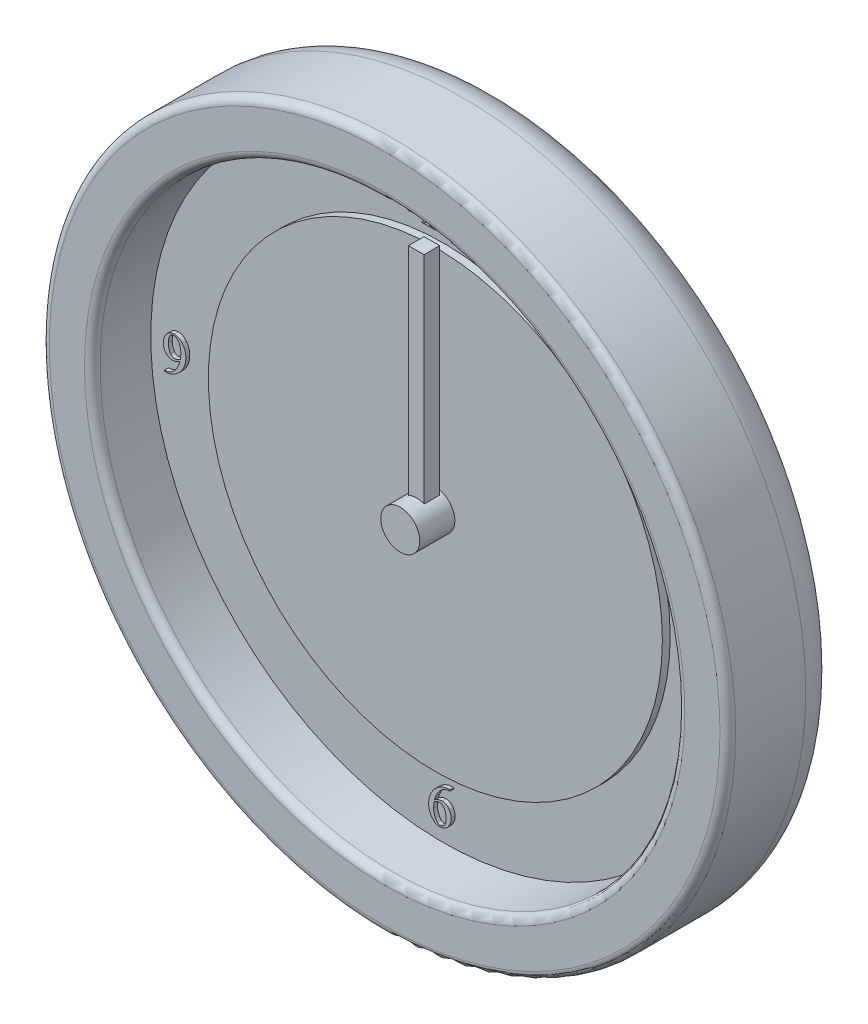
from build123d import *

# Parameters (mm, degrees)
SKETCH1_R            = 111.76
BOSS_EXTRUDE1_DEPTH  = 38.1
SKETCH2_R            = 95.25
CUT_EXTRUDE1_DEPTH   = 19.05
FILLET1_R            = 2.54
FILLET2_R            = 2.54
FILLET3_R            = 12.7
BOSS_EXTRUDE7_DEPTH  = 20.32
SKETCH4_R            = 6.35
BOSS_EXTRUDE8_DEPTH  = 13.97
SKETCH5_R            = 73.943171033
BOSS_EXTRUDE9_DEPTH  = 2.54
SKETCH6_W            = 5.08
SKETCH6_H            = 5.08
BOSS_EXTRUDE12_DEPTH = 76.2


with BuildPart() as part:
    # Sketch1 → Boss-Extrude1 (new body)
    with BuildSketch(Plane.XY):
        with Locations(Location((0, 0, 0), (0, 0, 180))):
            Circle(SKETCH1_R)
    extrude(amount=BOSS_EXTRUDE1_DEPTH)

    # Sketch2 → Cut-Extrude1 (cut)
    with BuildSketch(Plane.XY.offset(38.1)):
        Circle(SKETCH2_R)
    extrude(amount=-CUT_EXTRUDE1_DEPTH, mode=Mode.SUBTRACT)

    # Fillet1
    fillet1_edges = [part.edges().sort_by_distance(p)[0] for p in [
        (-95.25, 0, 38.1),
    ]]
    fillet(fillet1_edges, radius=FILLET1_R)

    # Fillet2
    fillet2_edges = [part.edges().sort_by_distance(p)[0] for p in [
        (111.76, 0, 38.1),
    ]]
    fillet(fillet2_edges, radius=FILLET2_R)

    # Fillet3
    fillet3_edges = [part.edges().sort_by_distance(p)[0] for p in [
        (111.76, 0, 0),
    ]]
    fillet(fillet3_edges, radius=FILLET3_R)

    # Sketch3 → Boss-Extrude7 (add)
    # profile 1 of 5: a face of its own
    with BuildSketch(Plane.XY):
        with BuildLine():
            Line((-5.75388779, 88.125760029), (-2.948611132, 89.430302853))
            Line((-2.948611132, 89.430302853), (-2.655598583, 89.430302853))
            Line((-2.655598583, 89.430302853), (-2.655598583, 79.646231672))
            add(Edge.make_bspline(
                [(-2.655598583, 79.646231672), (-2.654587099, 79.565552497), (-2.652670591, 79.412685694), (-2.652428934, 79.195145532), (-2.642505407, 79.002483635), (-2.637665058, 78.833153356), (-2.622670176, 78.688211965), (-2.612737323, 78.565249236), (-2.593972522, 78.466972643), (-2.572197261, 78.367611622), (-2.527322959, 78.266023365), (-2.451204632, 78.16146124), (-2.352854458, 78.072392027), (-2.227671184, 77.991718119), (-2.054179237, 77.935061791), (-1.82428506, 77.891100322), (-1.528314509, 77.862807229), (-1.308648477, 77.856144866), (-1.187987906, 77.852485289)],
                knots=[0, 0, 0, 0, 1.356933168, 2.571048021, 3.657379777, 4.601012336, 5.418253307, 6.107533085, 6.673460353, 7.099554724, 7.815972102, 8.521630774, 9.259509655, 10.036179522, 11.007509208, 12.304408113, 13.970044684, 16, 16, 16, 16], degree=3))
            Line((-1.187987906, 77.852485289), (-1.187987906, 77.526349583))
            Line((-1.187987906, 77.526349583), (-5.590819937, 77.526349583))
            Line((-5.590819937, 77.526349583), (-5.590819937, 77.852485289))
            add(Edge.make_bspline(
                [(-5.590819937, 77.852485289), (-5.467591539, 77.855984736), (-5.244494419, 77.862320259), (-4.946324027, 77.891869605), (-4.719395507, 77.931391262), (-4.552549752, 77.986786853), (-4.437330563, 78.065657451), (-4.34320301, 78.146019032), (-4.271554575, 78.241036136), (-4.220329465, 78.329520899), (-4.190427401, 78.420119835), (-4.175328155, 78.516452915), (-4.155809912, 78.638377842), (-4.145290521, 78.788345529), (-4.134884941, 78.964974728), (-4.12680821, 79.168002339), (-4.126004962, 79.398237803), (-4.124176263, 79.560453307), (-4.12320926, 79.646231672)],
                knots=[0, 0, 0, 0, 2.071302469, 3.74996044, 5.029173581, 5.941282905, 6.673651071, 7.361112001, 8.012044112, 8.663601818, 9.069808009, 9.607263055, 10.29959599, 11.144699654, 12.131164582, 13.273777592, 14.558393644, 16, 16, 16, 16], degree=3))
            Line((-4.12320926, 79.646231672), (-4.12320926, 86.00587794))
            add(Edge.make_bspline(
                [(-4.12320926, 86.00587794), (-4.122640277, 86.101008152), (-4.121553012, 86.282791459), (-4.128911149, 86.542621591), (-4.131184679, 86.77635111), (-4.143766859, 86.982559324), (-4.151098195, 87.162151909), (-4.16851871, 87.313840376), (-4.180721531, 87.440390417), (-4.19732904, 87.514357402), (-4.204743187, 87.547378738)],
                knots=[0, 0, 0, 0, 1.476765178, 2.821934835, 4.035278551, 5.104597693, 6.029081604, 6.824151588, 7.47506195, 8, 8, 8, 8], degree=3))
            add(Edge.make_bspline(
                [(-4.204743187, 87.547378738), (-4.215554023, 87.588492465), (-4.236046444, 87.666425365), (-4.282372737, 87.773406198), (-4.341452505, 87.864413436), (-4.43514491, 87.961472177), (-4.582891288, 88.049266691), (-4.715548821, 88.061119637), (-4.783124478, 88.067157519)],
                knots=[0, 0, 0, 0, 0.903062441, 1.711795068, 2.468214314, 3.196286531, 4.571790261, 6, 6, 6, 6], degree=3))
            add(Edge.make_bspline(
                [(-4.783124478, 88.067157519), (-4.83854234, 88.062631724), (-4.962012685, 88.052548306), (-5.160716596, 88.000981901), (-5.388178403, 87.914677091), (-5.546338439, 87.839919019), (-5.631586901, 87.799624323)],
                knots=[0, 0, 0, 0, 0.743837888, 1.657262055, 2.737261251, 4, 4, 4, 4], degree=3))
            Line((-5.631586901, 87.799624323), (-5.75388779, 88.125760029))
        make_face()
    # profile 2 of 5: a face of its own
    with BuildSketch(Plane.XY):
        with BuildLine():
            Line((8.92221898, 79.776176368), (8.109427651, 77.526349583))
            Line((8.109427651, 77.526349583), (1.258029889, 77.526349583))
            Line((1.258029889, 77.526349583), (1.258029889, 77.844841484))
            add(Edge.make_bspline(
                [(1.258029889, 77.844841484), (1.50318641, 78.070159756), (1.978355837, 78.506878118), (2.658475963, 79.150082345), (3.281569554, 79.762134709), (3.847785693, 80.342794631), (4.357645079, 80.891667256), (4.809944453, 81.410482973), (5.208403753, 81.894691378), (5.551174235, 82.353434183), (5.848962901, 82.789661663), (6.101221394, 83.215879983), (6.316337561, 83.631582783), (6.494649418, 84.037450977), (6.629920792, 84.435879645), (6.727504321, 84.824314686), (6.789426037, 85.203000738), (6.798087822, 85.452757707), (6.802336891, 85.57527689)],
                knots=[0, 0, 0, 0, 1.640196139, 3.179075376, 4.61094688, 5.942305235, 7.173872596, 8.30065911, 9.332401675, 10.262017718, 11.120692698, 11.932909408, 12.700076558, 13.425218913, 14.114511764, 14.770003029, 15.396620544, 16, 16, 16, 16], degree=3))
            add(Edge.make_bspline(
                [(6.802336891, 85.57527689), (6.800691717, 85.666262684), (6.797466664, 85.844623174), (6.762967423, 86.105459842), (6.709248296, 86.354236555), (6.637122297, 86.591732818), (6.537638762, 86.81491602), (6.422223779, 87.027690538), (6.279027448, 87.224488951), (6.120454417, 87.409423634), (5.945916439, 87.576215292), (5.761160531, 87.722171306), (5.569530126, 87.848701486), (5.36811603, 87.95130943), (5.156949723, 88.027313723), (4.938651077, 88.083470953), (4.71179838, 88.121398903), (4.556910787, 88.124295759), (4.478619986, 88.125760029)],
                knots=[0, 0, 0, 0, 1.134419306, 2.223815103, 3.275304008, 4.307399035, 5.313221346, 6.318597171, 7.32112197, 8.342723066, 9.354331769, 10.327252885, 11.276405737, 12.214555788, 13.139633085, 14.069852934, 15.024371439, 16, 16, 16, 16], degree=3))
            add(Edge.make_bspline(
                [(4.478619986, 88.125760029), (4.337067563, 88.120358914), (4.058327691, 88.109723236), (3.65325225, 88.010944258), (3.270342506, 87.853891012), (2.913506978, 87.634395669), (2.590042085, 87.354609576), (2.308631043, 87.015401501), (2.074802788, 86.61638457), (1.962915835, 86.321199774), (1.905205431, 86.168945793)],
                knots=[0, 0, 0, 0, 0.978774112, 1.927366301, 2.868767021, 3.835023234, 4.81480387, 5.817007219, 6.874029602, 8, 8, 8, 8], degree=3))
            Line((1.905205431, 86.168945793), (1.584165595, 86.168945793))
            add(Edge.make_bspline(
                [(1.584165595, 86.168945793), (1.603412897, 86.296721734), (1.641018009, 86.546368603), (1.729493999, 86.906040636), (1.834773377, 87.244313956), (1.966148761, 87.557656555), (2.113567652, 87.851301433), (2.284009917, 88.121101015), (2.476225354, 88.368472212), (2.691340165, 88.589553925), (2.921807834, 88.788435074), (3.168437106, 88.959485747), (3.427211576, 89.107715474), (3.702874404, 89.222704605), (3.99068936, 89.316239995), (4.292030092, 89.381212809), (4.6073294, 89.42414128), (4.822444591, 89.428221803), (4.932152452, 89.430302853)],
                knots=[0, 0, 0, 0, 1.200501633, 2.345523519, 3.439068721, 4.490246694, 5.499995932, 6.48995494, 7.451685612, 8.406391985, 9.352574024, 10.27676432, 11.192316343, 12.119031984, 13.047762957, 14.001652993, 14.980851257, 16, 16, 16, 16], degree=3))
            add(Edge.make_bspline(
                [(4.932152452, 89.430302853), (5.048610371, 89.427009147), (5.277145943, 89.420545619), (5.613549274, 89.380175484), (5.934894366, 89.308222099), (6.243032249, 89.209757025), (6.533557905, 89.077779145), (6.811783962, 88.922837426), (7.072254367, 88.73433557), (7.316430839, 88.52243735), (7.5407699, 88.292729719), (7.733273705, 88.046627643), (7.902921804, 87.79444451), (8.033787134, 87.527411284), (8.140162177, 87.25237201), (8.217075431, 86.967404509), (8.260756941, 86.670545804), (8.266850515, 86.469742725), (8.269947568, 86.367684739)],
                knots=[0, 0, 0, 0, 1.109419983, 2.177111989, 3.221343547, 4.242152537, 5.252521162, 6.255999647, 7.270763728, 8.308866099, 9.333003754, 10.32358272, 11.281716678, 12.222409134, 13.149434629, 14.0874794, 15.027963099, 16, 16, 16, 16], degree=3))
            add(Edge.make_bspline(
                [(8.269947568, 86.367684739), (8.265238161, 86.219532574), (8.255753069, 85.921143248), (8.171689982, 85.476290551), (8.043131359, 85.030184668), (7.916676591, 84.743369061), (7.852086195, 84.596869772)],
                knots=[0, 0, 0, 0, 0.968670703, 1.950973842, 2.953401185, 4, 4, 4, 4], degree=3))
            add(Edge.make_bspline(
                [(7.852086195, 84.596869772), (7.795885775, 84.478854677), (7.681279524, 84.238193355), (7.475959084, 83.884868851), (7.252692526, 83.523087692), (7.005073694, 83.154860297), (6.730079233, 82.783656607), (6.427129812, 82.409637183), (6.104903926, 82.026124845), (5.874968531, 81.774638536), (5.757683458, 81.646360807)],
                knots=[0, 0, 0, 0, 0.863272392, 1.760421205, 2.69783519, 3.672094839, 4.691137575, 5.748887515, 6.851756197, 8, 8, 8, 8], degree=3))
            add(Edge.make_bspline(
                [(5.757683458, 81.646360807), (5.584535221, 81.467897497), (5.254975524, 81.128221419), (4.784015183, 80.646249069), (4.359126511, 80.218401712), (3.986430637, 79.837776692), (3.657984148, 79.51220991), (3.377132229, 79.239313512), (3.145862974, 79.016986053), (3.006072637, 78.887627048), (2.944762994, 78.830892407)],
                knots=[0, 0, 0, 0, 1.49931882, 2.853711152, 4.0632012, 5.135089847, 6.065735724, 6.851603135, 7.496332836, 8, 8, 8, 8], degree=3))
            Line((2.944762994, 78.830892407), (6.045600136, 78.830892407))
            add(Edge.make_bspline(
                [(6.045600136, 78.830892407), (6.191696461, 78.831852326), (6.460171425, 78.833616328), (6.828046907, 78.846295059), (7.125032362, 78.863806637), (7.362069691, 78.894207969), (7.559222245, 78.939571757), (7.73660079, 79.000640886), (7.905735286, 79.077595334), (8.064299604, 79.175770248), (8.215283417, 79.292200873), (8.353759428, 79.433191156), (8.485260577, 79.592826721), (8.558499483, 79.713996192), (8.596083274, 79.776176368)],
                knots=[0, 0, 0, 0, 1.821637222, 3.347544769, 4.589491042, 5.530053278, 6.323823777, 7.107498442, 7.865641253, 8.635746017, 9.428031577, 10.236778878, 11.095173072, 12, 12, 12, 12], degree=3))
            Line((8.596083274, 79.776176368), (8.92221898, 79.776176368))
        make_face()
    # profile 3 of 5: a face of its own
    with BuildSketch(Plane.XY):
        with BuildLine():
            add(Edge.make_bspline(
                [(84.095597607, 2.795514807), (84.138208974, 2.89095857), (84.221545682, 3.077621645), (84.356012675, 3.346794434), (84.502878672, 3.59778303), (84.65629814, 3.832912008), (84.818486594, 4.051098251), (84.985708897, 4.253838274), (85.165436406, 4.436914277), (85.351234166, 4.606200469), (85.546983167, 4.75853285), (85.758052941, 4.88500563), (85.978366999, 4.995631464), (86.20968419, 5.087978769), (86.454099868, 5.156775375), (86.709234099, 5.203782021), (86.975639806, 5.236217483), (87.157266074, 5.23973684), (87.249941388, 5.241532602)],
                knots=[0, 0, 0, 0, 1.176091227, 2.300127321, 3.3835767, 4.446473798, 5.457585235, 6.441364894, 7.401036819, 8.341531155, 9.268576939, 10.186414906, 11.105297085, 12.040532869, 12.984371496, 13.957134865, 14.957622323, 16, 16, 16, 16], degree=3))
            add(Edge.make_bspline(
                [(87.249941388, 5.241532602), (87.362998498, 5.238217568), (87.583912739, 5.231739973), (87.905335206, 5.192435244), (88.206485298, 5.11986845), (88.487237654, 5.021428479), (88.748388121, 4.893594817), (88.985126683, 4.732494406), (89.208718871, 4.550912747), (89.334474742, 4.40530189), (89.397850765, 4.331919735)],
                knots=[0, 0, 0, 0, 1.123808988, 2.195929207, 3.211426243, 4.196579678, 5.14788152, 6.09136163, 7.038121192, 8, 8, 8, 8], degree=3))
            add(Edge.make_bspline(
                [(89.397850765, 4.331919735), (89.485416851, 4.22006281), (89.654440877, 4.00415151), (89.831559003, 3.641045504), (89.945553095, 3.267837557), (89.959231019, 3.012037684), (89.966040315, 2.884692539)],
                knots=[0, 0, 0, 0, 1.071729872, 2.068701529, 3.038539469, 4, 4, 4, 4], degree=3))
            add(Edge.make_bspline(
                [(89.966040315, 2.884692539), (89.960999465, 2.778086606), (89.950752033, 2.561369787), (89.869301704, 2.237033292), (89.740295178, 1.911100547), (89.559179465, 1.583403902), (89.326629094, 1.253821552), (89.045692891, 0.920276144), (88.712426553, 0.585545054), (88.464331944, 0.373235024), (88.335361785, 0.262867215)],
                knots=[0, 0, 0, 0, 0.802544778, 1.631475345, 2.504987027, 3.438672434, 4.445331875, 5.540090885, 6.721234327, 8, 8, 8, 8], degree=3))
            add(Edge.make_bspline(
                [(88.335361785, 0.262867215), (88.420853006, 0.227593405), (88.588539571, 0.158405669), (88.826686737, 0.034953234), (89.047358605, -0.100874647), (89.255780804, -0.242222924), (89.44515133, -0.399128325), (89.618409274, -0.56746662), (89.776810754, -0.746334283), (89.920283325, -0.934656907), (90.045360983, -1.134804294), (90.154284359, -1.343870592), (90.250202047, -1.559921316), (90.32329037, -1.786750621), (90.381745564, -2.020901383), (90.425405698, -2.263359854), (90.451593573, -2.514647948), (90.454012892, -2.68503059), (90.455243874, -2.771723612)],
                knots=[0, 0, 0, 0, 1.121628463, 2.200015641, 3.249715177, 4.264389965, 5.252559056, 6.229000805, 7.192526379, 8.148751574, 9.09789992, 10.051957494, 11.00718286, 11.961907919, 12.939056191, 13.933490933, 14.948531889, 16, 16, 16, 16], degree=3))
            add(Edge.make_bspline(
                [(90.455243874, -2.771723612), (90.452219237, -2.895853202), (90.446275423, -3.139784363), (90.401837176, -3.499606164), (90.329159072, -3.846237405), (90.222547928, -4.17973217), (90.090898283, -4.502144926), (89.926452947, -4.81147072), (89.732889677, -5.108427763), (89.582991435, -5.292895539), (89.507411978, -5.38590513)],
                knots=[0, 0, 0, 0, 1.048019005, 2.059496798, 3.056839529, 4.034491814, 5.012117791, 5.993865523, 6.98849678, 8, 8, 8, 8], degree=3))
            add(Edge.make_bspline(
                [(89.507411978, -5.38590513), (89.401439938, -5.500850506), (89.190154588, -5.730026747), (88.824513523, -6.02281695), (88.426443604, -6.27144467), (87.994554823, -6.477682845), (87.526216317, -6.634397629), (87.024117346, -6.745863668), (86.488208374, -6.812637694), (86.119702967, -6.821122949), (85.930110953, -6.82548852)],
                knots=[0, 0, 0, 0, 0.9408645, 1.875880513, 2.811526398, 3.763677692, 4.752375993, 5.780273647, 6.857974994, 8, 8, 8, 8], degree=3))
            add(Edge.make_bspline(
                [(85.930110953, -6.82548852), (85.83751913, -6.82441696), (85.659888878, -6.822361253), (85.404939319, -6.809460161), (85.172681855, -6.790185709), (84.963092485, -6.760633383), (84.777320865, -6.718745736), (84.612759408, -6.674807256), (84.47085401, -6.619646917), (84.321602298, -6.533337515), (84.17020444, -6.420595449), (84.037657154, -6.271373834), (83.947785996, -6.116703138), (83.93748597, -6.006920446), (83.932529754, -5.954094681)],
                knots=[0, 0, 0, 0, 1.402226433, 2.690062984, 3.865046374, 4.930988681, 5.892224942, 6.747350114, 7.509271635, 8.188907461, 9.354277059, 10.347676201, 11.204926872, 12, 12, 12, 12], degree=3))
            add(Edge.make_bspline(
                [(83.932529754, -5.954094681), (83.935070116, -5.915577369), (83.940094452, -5.839397738), (83.978188476, -5.728858546), (84.039725755, -5.625545649), (84.128012735, -5.535574143), (84.229760432, -5.456301983), (84.346630014, -5.401108632), (84.471027437, -5.361825158), (84.558154677, -5.359211979), (84.602636712, -5.357877843)],
                knots=[0, 0, 0, 0, 0.930288779, 1.839927393, 2.798379237, 3.815801145, 4.871906534, 5.901086166, 6.928418261, 8, 8, 8, 8], degree=3))
            add(Edge.make_bspline(
                [(84.602636712, -5.357877843), (84.673434022, -5.35977352), (84.818036651, -5.363645417), (84.958829184, -5.396939226), (85.030689826, -5.413932418)],
                knots=[0, 0, 0, 0, 0.9791981, 2, 2, 2, 2], degree=3))
            add(Edge.make_bspline(
                [(85.030689826, -5.413932418), (85.062188791, -5.423902809), (85.140319758, -5.448633663), (85.279130543, -5.500746484), (85.461809714, -5.578346507), (85.67604942, -5.671521039), (85.89308012, -5.766315939), (86.086093853, -5.842374788), (86.240319979, -5.898538302), (86.331687585, -5.923148279), (86.370903743, -5.933711199)],
                knots=[0, 0, 0, 0, 0.551098561, 1.366961252, 2.47206847, 3.861764831, 5.264472469, 6.422097681, 7.322743916, 8, 8, 8, 8], degree=3))
            add(Edge.make_bspline(
                [(86.370903743, -5.933711199), (86.476717764, -5.955375358), (86.694446276, -5.999952674), (86.916619729, -6.006687495), (87.030818961, -6.010149255)],
                knots=[0, 0, 0, 0, 0.971981303, 2, 2, 2, 2], degree=3))
            add(Edge.make_bspline(
                [(87.030818961, -6.010149255), (87.101475459, -6.008555733), (87.241047931, -6.005407943), (87.445421982, -5.969386232), (87.643576855, -5.920216727), (87.834081954, -5.844837731), (88.016414676, -5.747147155), (88.194661528, -5.632538533), (88.362357412, -5.493429055), (88.521922707, -5.336677583), (88.667628568, -5.164664502), (88.799286806, -4.984892975), (88.905783774, -4.793846891), (88.996499879, -4.597670738), (89.064338561, -4.392189565), (89.1170767, -4.180473701), (89.144123204, -3.959763041), (89.148488657, -3.810492682), (89.15070105, -3.734843119)],
                knots=[0, 0, 0, 0, 0.98287937, 1.941546881, 2.88253887, 3.822638359, 4.785601421, 5.759974566, 6.768635762, 7.814143594, 8.871295523, 9.905298752, 10.911738224, 11.912182368, 12.910876931, 13.920716429, 14.946228209, 16, 16, 16, 16], degree=3))
            add(Edge.make_bspline(
                [(89.15070105, -3.734843119), (89.14738922, -3.622490464), (89.140778093, -3.398210345), (89.083567622, -3.065734449), (88.999467709, -2.735547349), (88.912142271, -2.524521701), (88.867880242, -2.417560619)],
                knots=[0, 0, 0, 0, 0.993065039, 1.982371906, 2.977339071, 4, 4, 4, 4], degree=3))
            add(Edge.make_bspline(
                [(88.867880242, -2.417560619), (88.833654608, -2.342057844), (88.768124984, -2.197497526), (88.651611484, -2.002656741), (88.537592153, -1.830233904), (88.447154443, -1.736137169), (88.404156035, -1.691399086)],
                knots=[0, 0, 0, 0, 1.146959708, 2.196010144, 3.142297047, 4, 4, 4, 4], degree=3))
            add(Edge.make_bspline(
                [(88.404156035, -1.691399086), (88.342521084, -1.633882176), (88.213613227, -1.513587093), (87.987680834, -1.355876081), (87.730874547, -1.205138594), (87.447915715, -1.065012202), (87.148515391, -0.943057169), (86.838631505, -0.854940514), (86.52553305, -0.803203683), (86.315032529, -0.795705582), (86.210383825, -0.791977959)],
                knots=[0, 0, 0, 0, 0.833783525, 1.743836022, 2.720158816, 3.780630828, 4.867413274, 5.916185896, 6.964047963, 8, 8, 8, 8], degree=3))
            Line((86.210383825, -0.791977959), (85.950494435, -0.791977959))
            Line((85.950494435, -0.791977959), (85.950494435, -0.465842253))
            add(Edge.make_bspline(
                [(85.950494435, -0.465842253), (86.066507923, -0.447939435), (86.301374334, -0.411695628), (86.649971363, -0.309929048), (86.996572873, -0.167592704), (87.33812925, 0.004471306), (87.658371519, 0.205977347), (87.936406268, 0.43481377), (88.169435177, 0.682547347), (88.350673419, 0.95234691), (88.4893605, 1.238656021), (88.589482315, 1.538194784), (88.649481563, 1.852095258), (88.657459363, 2.065698782), (88.661497491, 2.173818618)],
                knots=[0, 0, 0, 0, 1.018822759, 2.062581231, 3.144841569, 4.269905924, 5.381171259, 6.423990724, 7.389747841, 8.324839968, 9.23548737, 10.145327579, 11.061219247, 12, 12, 12, 12], degree=3))
            add(Edge.make_bspline(
                [(88.661497491, 2.173818618), (88.660548918, 2.243582811), (88.658678275, 2.3811619), (88.628514515, 2.58122791), (88.586767554, 2.773220995), (88.521936226, 2.952577359), (88.443738518, 3.124139473), (88.341521656, 3.281335829), (88.228786859, 3.434167853), (88.092267859, 3.56861585), (87.948688155, 3.694839749), (87.791485663, 3.802161452), (87.626204528, 3.892780903), (87.453510865, 3.971960223), (87.270929685, 4.029123044), (87.07979587, 4.06981371), (86.880402921, 4.096619929), (86.743840796, 4.098895603), (86.674108032, 4.100057631)],
                knots=[0, 0, 0, 0, 1.07791789, 2.125717433, 3.123144222, 4.111969722, 5.069857656, 6.032059613, 7.006823601, 8.000784083, 8.988212443, 9.96111577, 10.93720663, 11.90155836, 12.894476591, 13.889044549, 14.92208211, 16, 16, 16, 16], degree=3))
            add(Edge.make_bspline(
                [(86.674108032, 4.100057631), (86.562555311, 4.095459859), (86.341704749, 4.086357252), (86.016334761, 4.019130315), (85.707521402, 3.901797328), (85.40949341, 3.746267305), (85.131441907, 3.537998445), (84.864917793, 3.288653363), (84.610954186, 2.994559883), (84.462686048, 2.772622059), (84.38606222, 2.657926306)],
                knots=[0, 0, 0, 0, 0.945780098, 1.8724426, 2.802290766, 3.739917435, 4.713776979, 5.738108685, 6.831072039, 8, 8, 8, 8], degree=3))
            Line((84.38606222, 2.657926306), (84.095597607, 2.795514807))
        make_face()
    # profile 4 of 5: a face of its own
    with BuildSketch(Plane.XY):
        with BuildLine():
            Line((-89.559201335, -6.394756041), (-89.559201335, -6.068620335))
            add(Edge.make_bspline(
                [(-89.559201335, -6.068620335), (-89.379591419, -6.060058037), (-89.023787869, -6.0430963), (-88.500544616, -5.944507518), (-87.998406489, -5.783493555), (-87.593487458, -5.607246038), (-87.281551091, -5.42797416), (-87.050081953, -5.267980889), (-86.81645176, -5.090337626), (-86.588105004, -4.885202817), (-86.360971013, -4.658138378), (-86.137617626, -4.407950878), (-85.914569017, -4.136197035), (-85.695486083, -3.844170719), (-85.485058696, -3.53496726), (-85.288319914, -3.214184269), (-85.110316639, -2.8829748), (-84.949594521, -2.542470835), (-84.803339692, -2.193609037), (-84.677591424, -1.833865709), (-84.56307455, -1.466581059), (-84.503503176, -1.216043217), (-84.473522669, -1.089954948)],
                knots=[0, 0, 0, 0, 1.403753885, 2.780807579, 4.145009348, 5.517530429, 6.22211579, 6.952842085, 7.714724661, 8.513818649, 9.34907323, 10.223127842, 11.133146991, 12.095383574, 13.074587166, 14.054510068, 15.034320612, 16.010934816, 16.995632226, 17.988413566, 18.987628183, 20, 20, 20, 20], degree=3))
            add(Edge.make_bspline(
                [(-84.473522669, -1.089954948), (-84.583088068, -1.161831273), (-84.796978918, -1.30214645), (-85.123134225, -1.483784497), (-85.438947674, -1.641983079), (-85.749078517, -1.766228128), (-86.049754263, -1.867175473), (-86.342672748, -1.939463153), (-86.628709031, -1.981511696), (-86.816646319, -1.988484559), (-86.909348723, -1.99192401)],
                knots=[0, 0, 0, 0, 1.193571056, 2.330059758, 3.39946611, 4.409696585, 5.371428751, 6.28736185, 7.155219939, 8, 8, 8, 8], degree=3))
            add(Edge.make_bspline(
                [(-86.909348723, -1.99192401), (-87.009710333, -1.98881237), (-87.207977127, -1.982665249), (-87.499571838, -1.939089975), (-87.780446647, -1.864067146), (-88.050976724, -1.760065116), (-88.309187285, -1.623677621), (-88.556352145, -1.458370404), (-88.792629264, -1.264666138), (-89.016618287, -1.044040267), (-89.219705634, -0.797237554), (-89.399254713, -0.528966065), (-89.549584321, -0.239848952), (-89.672111255, 0.068608069), (-89.769156326, 0.395082883), (-89.837460832, 0.741365023), (-89.879044871, 1.107037603), (-89.883205841, 1.357647901), (-89.885337041, 1.486007543)],
                knots=[0, 0, 0, 0, 0.941470417, 1.85989764, 2.758653354, 3.664270839, 4.573142615, 5.492502656, 6.449524564, 7.435563604, 8.437444669, 9.442994713, 10.458753649, 11.488604209, 12.552539664, 13.649559315, 14.796131987, 16, 16, 16, 16], degree=3))
            add(Edge.make_bspline(
                [(-89.885337041, 1.486007543), (-89.883466996, 1.611864391), (-89.879753315, 1.861800705), (-89.832510293, 2.229970475), (-89.769513877, 2.589701827), (-89.669938073, 2.936312506), (-89.549410194, 3.27523984), (-89.394167439, 3.599516098), (-89.219182214, 3.917898484), (-89.079569108, 4.116693424), (-89.008847331, 4.21739408)],
                knots=[0, 0, 0, 0, 1.034368591, 2.054129574, 3.048749262, 4.035093445, 5.016180263, 6.003612089, 6.988718856, 8, 8, 8, 8], degree=3))
            add(Edge.make_bspline(
                [(-89.008847331, 4.21739408), (-88.920642181, 4.333487897), (-88.748053765, 4.560645245), (-88.449509216, 4.855711218), (-88.134970432, 5.109432043), (-87.797673358, 5.314121076), (-87.441983908, 5.477704953), (-87.063170655, 5.587983821), (-86.665787399, 5.660008615), (-86.393291093, 5.668129652), (-86.254529376, 5.672265082)],
                knots=[0, 0, 0, 0, 1.077697514, 2.108698964, 3.097080646, 4.061760366, 5.02087614, 5.985228253, 6.974029447, 8, 8, 8, 8], degree=3))
            add(Edge.make_bspline(
                [(-86.254529376, 5.672265082), (-86.137076392, 5.66918757), (-85.905035107, 5.663107608), (-85.564288153, 5.604133148), (-85.235414911, 5.513451808), (-84.920697968, 5.381491654), (-84.618558983, 5.215747396), (-84.330973227, 5.011000377), (-84.053789769, 4.771658516), (-83.886466692, 4.58702543), (-83.800867776, 4.492571082)],
                knots=[0, 0, 0, 0, 1.001261744, 1.978102677, 2.941602562, 3.9064639, 4.882659592, 5.875812541, 6.913311016, 8, 8, 8, 8], degree=3))
            add(Edge.make_bspline(
                [(-83.800867776, 4.492571082), (-83.700661904, 4.369596486), (-83.50096903, 4.124529502), (-83.246898366, 3.723694836), (-83.029618017, 3.303561955), (-82.853009395, 2.861368931), (-82.714345102, 2.398574807), (-82.619417718, 1.912918447), (-82.558965014, 1.406845431), (-82.551220883, 1.062376005), (-82.547283655, 0.88724277)],
                knots=[0, 0, 0, 0, 0.975249514, 1.943502664, 2.913361846, 3.881741885, 4.868721614, 5.881196686, 6.922769767, 8, 8, 8, 8], degree=3))
            add(Edge.make_bspline(
                [(-82.547283655, 0.88724277), (-82.550438131, 0.727484468), (-82.556708237, 0.409935188), (-82.600345278, -0.06175732), (-82.675077833, -0.524461226), (-82.776890301, -0.980025343), (-82.908974101, -1.428020133), (-83.072728016, -1.866836942), (-83.265712363, -2.296630002), (-83.48239987, -2.718533538), (-83.731049195, -3.125389131), (-83.999880393, -3.51729847), (-84.29246258, -3.89179299), (-84.607357448, -4.248296198), (-84.948760698, -4.584997374), (-85.309537424, -4.906702367), (-85.696062751, -5.208338122), (-85.967298181, -5.393986957), (-86.104201199, -5.487691109)],
                knots=[0, 0, 0, 0, 1.007177407, 2.001952053, 2.983495718, 3.960383814, 4.943066043, 5.925748271, 6.910892874, 7.911959716, 8.913842499, 9.914909341, 10.906768658, 11.908179135, 12.911548943, 13.928077192, 14.954220372, 16, 16, 16, 16], degree=3))
            add(Edge.make_bspline(
                [(-86.104201199, -5.487691109), (-86.217906389, -5.559789365), (-86.444261477, -5.703316738), (-86.797673828, -5.888357611), (-87.158906148, -6.044643153), (-87.527506907, -6.173079453), (-87.904227904, -6.2716158), (-88.288831379, -6.344497517), (-88.681008855, -6.384559596), (-88.945066529, -6.391347865), (-89.077641581, -6.394756041)],
                knots=[0, 0, 0, 0, 1.023958831, 2.038414359, 3.031070775, 4.016000478, 5.004927743, 5.990874236, 6.991281152, 8, 8, 8, 8], degree=3))
            Line((-89.077641581, -6.394756041), (-89.559201335, -6.394756041))
        make_face()
        with BuildLine():
            add(Edge.make_bspline(
                [(-84.341030039, -0.447875277), (-84.316213617, -0.26964646), (-84.269251212, 0.067632375), (-84.218628523, 0.546008414), (-84.185004982, 0.968298163), (-84.180199118, 1.23116238), (-84.177962186, 1.353514912)],
                knots=[0, 0, 0, 0, 1.192878819, 2.257394654, 3.188888554, 4, 4, 4, 4], degree=3))
            add(Edge.make_bspline(
                [(-84.177962186, 1.353514912), (-84.181788291, 1.49633023), (-84.18962239, 1.788750077), (-84.242556076, 2.235063888), (-84.330299221, 2.697907669), (-84.449633, 3.165533089), (-84.595917171, 3.616059879), (-84.776655182, 4.02154199), (-84.984032219, 4.37315644), (-85.224487926, 4.662389877), (-85.485671928, 4.894951325), (-85.769294875, 5.060959696), (-86.072661066, 5.164008713), (-86.281775663, 5.176682745), (-86.387022007, 5.183061522)],
                knots=[0, 0, 0, 0, 1.062187864, 2.174870431, 3.338257157, 4.563963245, 5.762542175, 6.856781212, 7.85998215, 8.788504847, 9.643645159, 10.447577079, 11.218673208, 12, 12, 12, 12], degree=3))
            add(Edge.make_bspline(
                [(-86.387022007, 5.183061522), (-86.448335221, 5.181355087), (-86.570184412, 5.177963848), (-86.748860371, 5.143062343), (-86.922763556, 5.089269896), (-87.090046076, 5.012313153), (-87.252639454, 4.915344423), (-87.405377252, 4.792385401), (-87.557011681, 4.653321051), (-87.698152044, 4.489197644), (-87.833229586, 4.307364325), (-87.942570532, 4.09849691), (-88.041628844, 3.872877452), (-88.119633884, 3.624124985), (-88.180123302, 3.35471183), (-88.222226407, 3.064197409), (-88.252055696, 2.75379975), (-88.253773807, 2.53923107), (-88.254658511, 2.428743568)],
                knots=[0, 0, 0, 0, 0.792605237, 1.575163013, 2.346916721, 3.143778403, 3.952453891, 4.790187528, 5.676756025, 6.61148235, 7.587682155, 8.600865576, 9.654441308, 10.773736515, 11.968321315, 13.224332763, 14.570730166, 16, 16, 16, 16], degree=3))
            add(Edge.make_bspline(
                [(-88.254658511, 2.428743568), (-88.251876945, 2.280063484), (-88.246481546, 1.991668871), (-88.214430478, 1.571032107), (-88.155376854, 1.175377942), (-88.075413938, 0.803678706), (-87.970096112, 0.457019998), (-87.84377282, 0.134613609), (-87.691270844, -0.162356901), (-87.570130724, -0.343608735), (-87.510661431, -0.432587666)],
                knots=[0, 0, 0, 0, 1.188001522, 2.304365394, 3.367682703, 4.381928793, 5.33932953, 6.259201211, 7.145418771, 8, 8, 8, 8], degree=3))
            add(Edge.make_bspline(
                [(-87.510661431, -0.432587666), (-87.464783313, -0.491013346), (-87.37549249, -0.604725008), (-87.230957711, -0.75994408), (-87.073941252, -0.887603005), (-86.910120137, -0.993446916), (-86.737994099, -1.075498906), (-86.557749512, -1.135757434), (-86.368627209, -1.167897515), (-86.240196408, -1.173675875), (-86.175543385, -1.176584745)],
                knots=[0, 0, 0, 0, 1.120678164, 2.181132964, 3.191801348, 4.165735877, 5.117156532, 6.061301103, 7.024044508, 8, 8, 8, 8], degree=3))
            add(Edge.make_bspline(
                [(-86.175543385, -1.176584745), (-86.108302919, -1.173782955), (-85.967886779, -1.167932067), (-85.749085207, -1.128834648), (-85.512711655, -1.071176646), (-85.264620512, -0.986732237), (-85.012966028, -0.885154519), (-84.771291845, -0.761655702), (-84.547361549, -0.61436062), (-84.409809328, -0.503372101), (-84.341030039, -0.447875277)],
                knots=[0, 0, 0, 0, 0.80316604, 1.677226265, 2.649266336, 3.708091079, 4.804695908, 5.889265069, 6.944583761, 8, 8, 8, 8], degree=3))
        make_face(mode=Mode.SUBTRACT)
    # profile 5 of 5: a face of its own
    with BuildSketch(Plane.XY):
        with BuildLine():
            Line((3.545716517, -77.990113118), (3.545716517, -78.316248824))
            add(Edge.make_bspline(
                [(3.545716517, -78.316248824), (3.369569245, -78.336748013), (3.031578435, -78.376081788), (2.551877483, -78.471090423), (2.12351529, -78.599259641), (1.736267962, -78.75328099), (1.37862689, -78.948972656), (1.030048549, -79.182815352), (0.684270169, -79.461886897), (0.344481812, -79.77946636), (0.02070802, -80.12842475), (-0.27809901, -80.501442773), (-0.549205283, -80.894170775), (-0.790554131, -81.311028588), (-1.006411351, -81.757772934), (-1.20122731, -82.240012895), (-1.380903993, -82.761136391), (-1.480859963, -83.125283177), (-1.532318343, -83.312749758)],
                knots=[0, 0, 0, 0, 1.112103864, 2.133901259, 3.062589416, 3.913366634, 4.74287887, 5.614630287, 6.543135065, 7.526908882, 8.529641219, 9.526369413, 10.522342764, 11.520138158, 12.544667767, 13.631892204, 14.7808733, 16, 16, 16, 16], degree=3))
            add(Edge.make_bspline(
                [(-1.532318343, -83.312749758), (-1.430604104, -83.23899445), (-1.231685423, -83.094753991), (-0.921492776, -82.909078361), (-0.612792135, -82.750132365), (-0.304199972, -82.618835283), (0.006373228, -82.518816534), (0.316718344, -82.447973134), (0.627833196, -82.402217272), (0.835408525, -82.396035512), (0.939178804, -82.392945149)],
                knots=[0, 0, 0, 0, 1.123331773, 2.196857368, 3.229697486, 4.227207333, 5.192971132, 6.143860852, 7.072085882, 8, 8, 8, 8], degree=3))
            add(Edge.make_bspline(
                [(0.939178804, -82.392945149), (1.037042809, -82.395741765), (1.229632021, -82.401245302), (1.513315544, -82.449259999), (1.786920306, -82.525351275), (2.051104829, -82.633161652), (2.303917719, -82.772209063), (2.548750865, -82.93936641), (2.782702574, -83.138323799), (3.002447653, -83.367192424), (3.205817076, -83.617754761), (3.385195698, -83.888571897), (3.535567083, -84.177492244), (3.65872099, -84.483977165), (3.755303052, -84.807184651), (3.823814201, -85.148290769), (3.865494544, -85.506325465), (3.869702925, -85.751008471), (3.871852223, -85.875972572)],
                knots=[0, 0, 0, 0, 0.926335326, 1.822960257, 2.716874761, 3.611657495, 4.518793541, 5.44474459, 6.414990309, 7.421923668, 8.445808242, 9.467636789, 10.493068566, 11.525261677, 12.591619706, 13.683314711, 14.816826316, 16, 16, 16, 16], degree=3))
            add(Edge.make_bspline(
                [(3.871852223, -85.875972572), (3.869930908, -85.998419794), (3.86612906, -86.240715151), (3.819774522, -86.599113988), (3.751321778, -86.949067544), (3.6578361, -87.292476278), (3.531845554, -87.626980268), (3.377640608, -87.953091506), (3.200966167, -88.273569591), (3.060878651, -88.475167282), (2.990266643, -88.576783888)],
                knots=[0, 0, 0, 0, 1.016603262, 2.01162791, 2.996823361, 3.9776384, 4.964449423, 5.961847612, 6.972656258, 8, 8, 8, 8], degree=3))
            add(Edge.make_bspline(
                [(2.990266643, -88.576783888), (2.901188142, -88.694528415), (2.726875415, -88.924936085), (2.42571974, -89.226053551), (2.105603887, -89.484272103), (1.762586042, -89.695118939), (1.396631225, -89.855724449), (1.011623915, -89.974925022), (0.603661233, -90.044332046), (0.324538149, -90.052815487), (0.182442049, -90.057134241)],
                knots=[0, 0, 0, 0, 1.070547348, 2.094894131, 3.081678243, 4.0500961, 5.007721965, 5.97488336, 6.96905275, 8, 8, 8, 8], degree=3))
            add(Edge.make_bspline(
                [(0.182442049, -90.057134241), (0.084664636, -90.054565112), (-0.107304453, -90.049521069), (-0.389767893, -90.013325071), (-0.660452933, -89.952641811), (-0.919985468, -89.865357403), (-1.167593813, -89.752097359), (-1.405769881, -89.617350911), (-1.631045563, -89.456434365), (-1.768714943, -89.332339343), (-1.838070567, -89.269822263)],
                knots=[0, 0, 0, 0, 1.054945317, 2.071203223, 3.06725916, 4.043942597, 5.020109906, 6.001126647, 6.992999677, 8, 8, 8, 8], degree=3))
            add(Edge.make_bspline(
                [(-1.838070567, -89.269822263), (-1.96855919, -89.140129908), (-2.227129353, -88.883137591), (-2.557401331, -88.452022536), (-2.838352918, -87.994276933), (-3.067736945, -87.508903408), (-3.247850435, -86.994969426), (-3.373865223, -86.452506857), (-3.452375821, -85.881668348), (-3.461531542, -85.491493289), (-3.466201162, -85.292495411)],
                knots=[0, 0, 0, 0, 0.996887487, 1.97538571, 2.93683217, 3.905260266, 4.881326787, 5.88466394, 6.921131994, 8, 8, 8, 8], degree=3))
            add(Edge.make_bspline(
                [(-3.466201162, -85.292495411), (-3.464049785, -85.163351965), (-3.459770373, -84.90646633), (-3.431232652, -84.522859032), (-3.383595628, -84.144230244), (-3.313356151, -83.770430311), (-3.227572755, -83.40203862), (-3.122499642, -83.037915638), (-2.997872414, -82.678838944), (-2.852551285, -82.325314221), (-2.689365446, -81.979630193), (-2.511547222, -81.64197168), (-2.313676752, -81.315971474), (-2.10384825, -80.997551942), (-1.874877943, -80.690506256), (-1.631880872, -80.392049441), (-1.367056337, -80.107298832), (-1.093039013, -79.831298461), (-0.808720799, -79.57429622), (-0.527061638, -79.33493172), (-0.249090139, -79.116955822), (0.027099513, -78.923243519), (0.299091498, -78.749011479), (0.569596403, -78.59826669), (0.836743237, -78.470301105), (1.184236973, -78.333815008), (1.607963633, -78.197514221), (2.106430168, -78.080133478), (2.587017846, -78.003566423), (2.902521314, -77.994525723), (3.056512958, -77.990113118)],
                knots=[0, 0, 0, 0, 1.006519091, 2.00211706, 2.996415824, 3.979256571, 4.965124328, 5.943496579, 6.931606334, 7.926081361, 8.921040949, 9.910081525, 10.898878399, 11.892118928, 12.881093046, 13.88292124, 14.890158396, 15.910556394, 16.913324523, 17.876166787, 18.79114971, 19.665330668, 20.504552116, 21.307593167, 22.077426548, 22.811271048, 24.215940873, 25.542181098, 26.800382202, 28, 28, 28, 28], degree=3))
            Line((3.056512958, -77.990113118), (3.545716517, -77.990113118))
        make_face()
        with BuildLine():
            add(Edge.make_bspline(
                [(-1.672454779, -83.942089753), (-1.697311697, -84.126263249), (-1.744551049, -84.476275947), (-1.794967777, -84.974213112), (-1.828546229, -85.416885849), (-1.8333012, -85.693320776), (-1.835522632, -85.822465933)],
                knots=[0, 0, 0, 0, 1.180646981, 2.243761695, 3.179518763, 4, 4, 4, 4], degree=3))
            add(Edge.make_bspline(
                [(-1.835522632, -85.822465933), (-1.832135674, -85.963633165), (-1.825193667, -86.252973595), (-1.764889295, -86.694759623), (-1.673395095, -87.154601798), (-1.545810395, -87.621706183), (-1.387150251, -88.075824704), (-1.185509119, -88.489908208), (-0.946459063, -88.854595103), (-0.754718115, -89.061565572), (-0.660924503, -89.162808984)],
                knots=[0, 0, 0, 0, 0.935169282, 1.916749931, 2.94995263, 4.040933046, 5.12340098, 6.132811626, 7.086630455, 8, 8, 8, 8], degree=3))
            add(Edge.make_bspline(
                [(-0.660924503, -89.162808984), (-0.588620016, -89.225802892), (-0.446436324, -89.349677725), (-0.191094934, -89.473704775), (0.083190888, -89.554664039), (0.275259376, -89.563440125), (0.373537189, -89.567930682)],
                knots=[0, 0, 0, 0, 1.006861896, 1.979951003, 2.966379127, 4, 4, 4, 4], degree=3))
            add(Edge.make_bspline(
                [(0.373537189, -89.567930682), (0.433124362, -89.566102542), (0.552383495, -89.562443663), (0.728334497, -89.528766501), (0.898485625, -89.470595624), (1.064846545, -89.395394259), (1.224370801, -89.293150714), (1.379254664, -89.170701092), (1.530676368, -89.026964014), (1.674678752, -88.861545078), (1.811343149, -88.677398308), (1.923983093, -88.468234105), (2.025299713, -88.244434815), (2.102452035, -87.999238024), (2.167647501, -87.737528178), (2.208293514, -87.454953554), (2.23861454, -87.154847023), (2.240305542, -86.947890403), (2.241173693, -86.841640014)],
                knots=[0, 0, 0, 0, 0.779018414, 1.559145301, 2.332118556, 3.127524297, 3.941341095, 4.803764059, 5.707564093, 6.668110459, 7.67041715, 8.699942935, 9.769402819, 10.879695731, 12.057326098, 13.294013432, 14.610761405, 16, 16, 16, 16], degree=3))
            add(Edge.make_bspline(
                [(2.241173693, -86.841640014), (2.240204606, -86.720972737), (2.238290954, -86.482691552), (2.208235016, -86.132461), (2.165695774, -85.793851242), (2.105754431, -85.467411348), (2.022709632, -85.154186764), (1.926909598, -84.852317797), (1.811783536, -84.56376644), (1.680937776, -84.290714284), (1.535139395, -84.037877332), (1.371349976, -83.815890167), (1.189577979, -83.630574192), (0.998426288, -83.472923536), (0.786143331, -83.357283418), (0.563154927, -83.266811237), (0.32197552, -83.219571899), (0.157136623, -83.212102384), (0.072880835, -83.208284414)],
                knots=[0, 0, 0, 0, 1.23656911, 2.44184803, 3.600569917, 4.734395033, 5.84091625, 6.920215375, 7.979166598, 9.022759962, 10.02170957, 10.967214311, 11.841492347, 12.677704233, 13.49628075, 14.309515386, 15.135925349, 16, 16, 16, 16], degree=3))
            add(Edge.make_bspline(
                [(0.072880835, -83.208284414), (-0.036488693, -83.215158007), (-0.268236756, -83.229722775), (-0.561770917, -83.322830325), (-0.824402673, -83.441501733), (-1.071573931, -83.568541586), (-1.358077419, -83.742026273), (-1.56232891, -83.872007847), (-1.672454779, -83.942089753)],
                knots=[0, 0, 0, 0, 1.024860307, 2.171623077, 2.859911253, 3.729199811, 4.775657197, 6, 6, 6, 6], degree=3))
        make_face(mode=Mode.SUBTRACT)
    extrude(amount=BOSS_EXTRUDE7_DEPTH)

    # Sketch4 → Boss-Extrude8 (add)
    with BuildSketch(Plane.XY.offset(19.05)):
        Circle(SKETCH4_R)
    extrude(amount=BOSS_EXTRUDE8_DEPTH)

    # Sketch5 → Boss-Extrude9 (add)
    with BuildSketch(Plane.XY.offset(19.05)):
        Circle(SKETCH5_R)
    extrude(amount=BOSS_EXTRUDE9_DEPTH)

    # Sketch6 → Boss-Extrude12 (add)
    with BuildSketch(Plane(origin=(0, 0, 0), x_dir=(1, 0, 0), z_dir=(0, 1, 0))):
        with Locations((-0.061492409, -25.203365213)):
            Rectangle(SKETCH6_W, SKETCH6_H)
    extrude(amount=BOSS_EXTRUDE12_DEPTH)


solid = part.part
